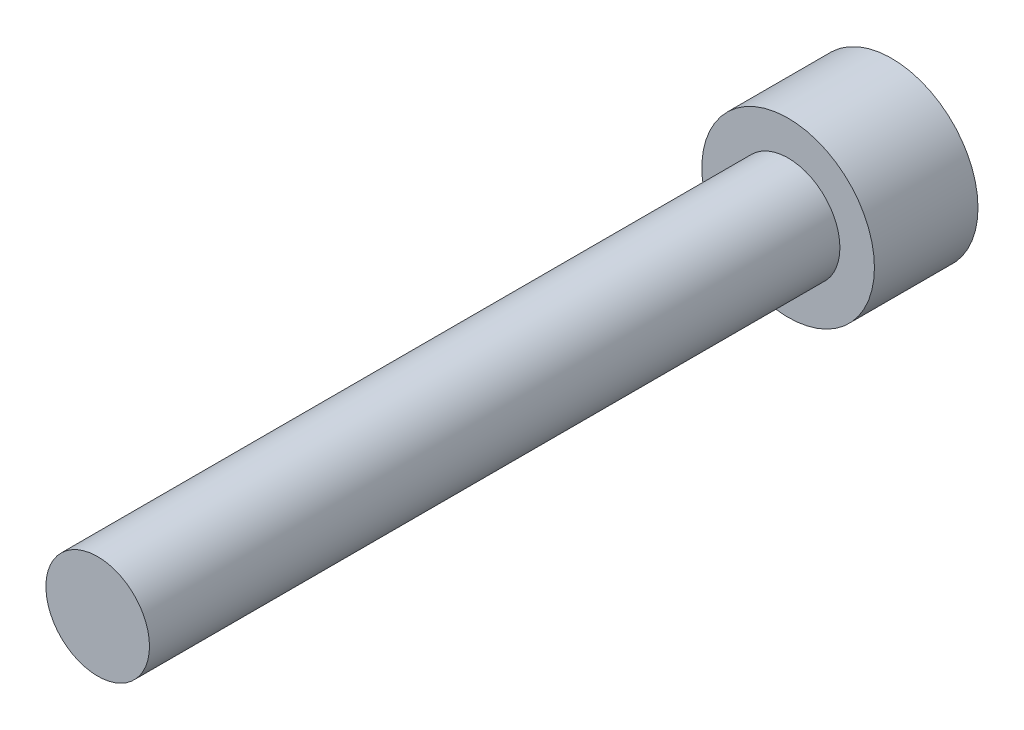
from build123d import *

# Parameters (mm, degrees)
SKETCH_1_R          = 5
EXTRUDE_1_DEPTH     = 6
SKETCH_2_R          = 3
EXTRUDE_2_DEPTH     = 40
CUT_EXTRUDE_1_DEPTH = 3


with BuildPart() as part:
    # ｽｹｯﾁ1 → ﾎﾞｽ - 押し出し1 (new body)
    with BuildSketch(Plane.XY):
        Circle(SKETCH_1_R)
    extrude(amount=EXTRUDE_1_DEPTH)

    # ｽｹｯﾁ2 → ﾎﾞｽ - 押し出し2 (add)
    with BuildSketch(Plane.XY.offset(6)):
        Circle(SKETCH_2_R)
    extrude(amount=EXTRUDE_2_DEPTH)

    # ｽｹｯﾁ3 → ｶｯﾄ - 押し出し1 (cut)
    with BuildSketch(Plane(origin=(0, 0, 0), x_dir=(-1, 0, 0), z_dir=(0, 0, -1))):
        Polygon((2.444628194, 2.36158951), (-0.822882412, 3.297904873), (-3.267510606, 0.936315364), (-2.444628194, -2.36158951), (0.822882412, -3.297904873), (3.267510606, -0.936315364), align=None)
    extrude(amount=-CUT_EXTRUDE_1_DEPTH, mode=Mode.SUBTRACT)


solid = part.part
